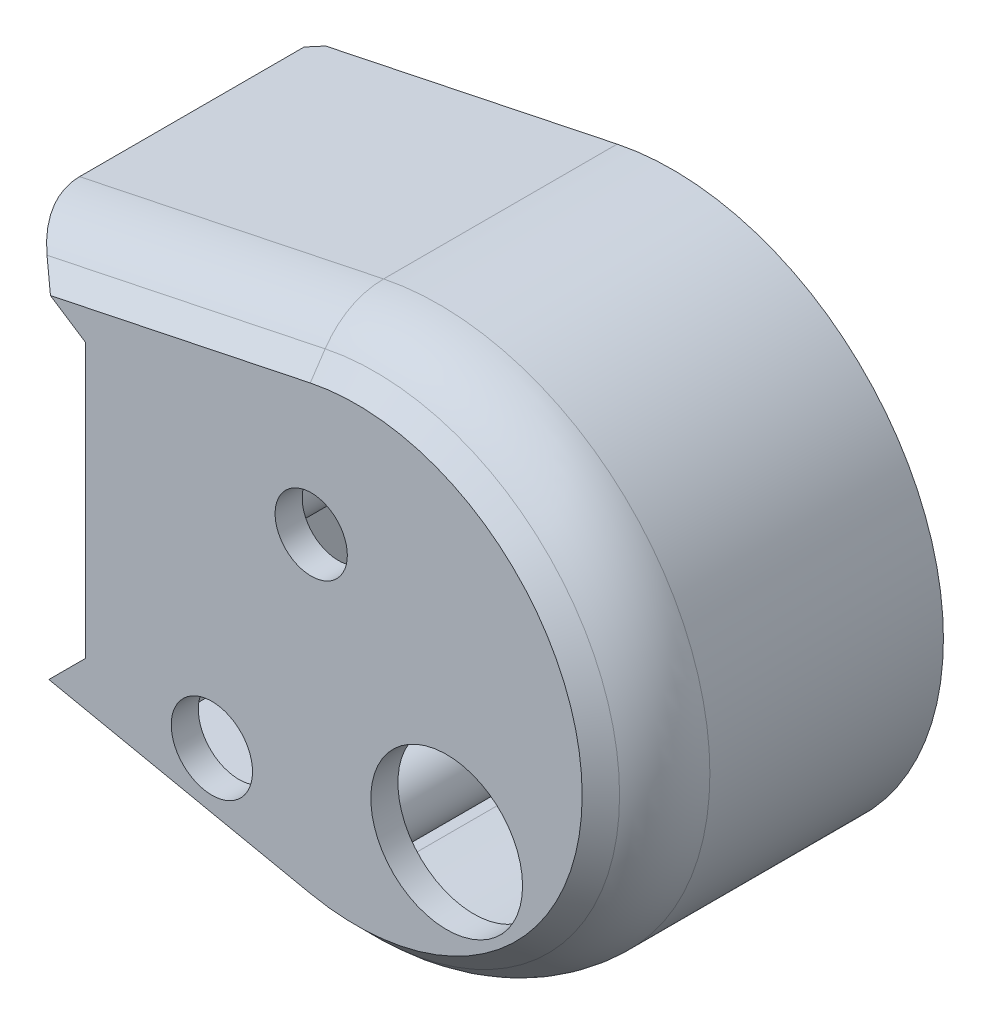
from build123d import *

# Parameters (mm, degrees)
CROQUIS13_R             = 4.5
CROQUIS13_R_2           = 8.4
CROQUIS13_R_3           = 4
SALIENTE_EXTRUIR5_DEPTH = 35
CORTAR_EXTRUIR7_DEPTH   = 32
CHAFL_N6_SIZE           = 5
CHAFL_N7_SIZE           = 2
CROQUIS15_R             = 4
CROQUIS15_R_2           = 1.25
SALIENTE_EXTRUIR9_DEPTH = 32
CHAFL_N8_SIZE           = 0.8
REDONDEO1_R             = 10
CHAFL_N9_SIZE           = 1


with BuildPart() as part:
    # Croquis13 → Saliente-Extruir5 (new body)
    with BuildSketch(Plane.XY):
        with BuildLine():
            Line((-6.126443354, 29.36778323), (-39.789261077, 22.345348329))
            Line((-39.789261077, 22.345348329), (-30, 15.935417314))
            Line((-30, 15.935417314), (-30, -14.387496114))
            Line((-30, -14.387496114), (-38.2739606, -22.661456714))
            Line((-38.2739606, -22.661456714), (-6.126443354, -29.36778323))
            ThreePointArc((-6.126443354, -29.36778323), (30, 0), (-6.126443354, 29.36778323))
        make_face()
        with Locations((-16, -16)):
            Circle(CROQUIS13_R, mode=Mode.SUBTRACT)
        with Locations((10, -12)):
            Circle(CROQUIS13_R_2, mode=Mode.SUBTRACT)
        with Locations((-5, 10)):
            Circle(CROQUIS13_R_3, mode=Mode.SUBTRACT)
    extrude(amount=-SALIENTE_EXTRUIR5_DEPTH)

    # Croquis14 → Cortar-Extruir7 (cut)
    with BuildSketch(Plane(origin=(0, 0, -35), x_dir=(-1, 0, 0), z_dir=(0, 0, -1))):
        with BuildLine():
            Line((27.5, -22.355204771), (5.615906408, -26.920467961))
            ThreePointArc((5.615906408, -26.920467961), (-27.5, 0), (5.615906408, 26.920467961))
            Line((5.615906408, 26.920467961), (27.5, 22.355204771))
            Line((27.5, 22.355204771), (27.5, -22.355204771))
        make_face()
    extrude(amount=-CORTAR_EXTRUIR7_DEPTH, mode=Mode.SUBTRACT)

    # Chaflán6
    chafl_n6_edges = [part.edges().sort_by_distance(p)[0] for p in [
        (-22.200201977, -26.014619972, 0),
        (-22.957852215, 25.856565779, 0),
        (30, 0, 0),
    ]]
    chamfer(chafl_n6_edges, length=CHAFL_N6_SIZE)

    # Chaflán7
    chafl_n7_edges = [part.edges().sort_by_distance(p)[0] for p in [
        (-16.557953204, 24.637836366, -3),
        (27.5, 0, -3),
        (-16.557953204, -24.637836366, -3),
    ]]
    chamfer(chafl_n7_edges, length=CHAFL_N7_SIZE)

    # Croquis15 → Saliente-Extruir9 (add)
    # profile 1 of 3: a face of its own
    with BuildSketch(Plane(origin=(0, 0, -3), x_dir=(-1, 0, 0), z_dir=(0, 0, -1))):
        with Locations(Location((22.5, 0, 0), (0, 0, 180))):
            Circle(CROQUIS15_R)
        with Locations(Location((22.5, 0, 0), (0, 0, 180))):
            Circle(CROQUIS15_R_2, mode=Mode.SUBTRACT)
    # profile 2 of 3: a face of its own
    with BuildSketch(Plane(origin=(0, 0, -3), x_dir=(-1, 0, 0), z_dir=(0, 0, -1))):
        with Locations(Location((6.952882373, -21.398771617, 0), (0, 0, 180))):
            Circle(CROQUIS15_R)
        with Locations(Location((6.952882373, -21.398771617, 0), (0, 0, 180))):
            Circle(CROQUIS15_R_2, mode=Mode.SUBTRACT)
    # profile 3 of 3: a face of its own
    with BuildSketch(Plane(origin=(0, 0, -3), x_dir=(-1, 0, 0), z_dir=(0, 0, -1))):
        with Locations(Location((-18.202882373, 13.225168177, 0), (0, 0, 180))):
            Circle(CROQUIS15_R)
        with Locations(Location((-18.202882373, 13.225168177, 0), (0, 0, 180))):
            Circle(CROQUIS15_R_2, mode=Mode.SUBTRACT)
    extrude(amount=SALIENTE_EXTRUIR9_DEPTH)

    # Chaflán8
    chafl_n8_edges = [part.edges().sort_by_distance(p)[0] for p in [
        (-23.75, 0, -35),
        (-8.202882373, -21.398771617, -35),
        (16.952882373, 13.225168177, -35),
    ]]
    chamfer(chafl_n8_edges, length=CHAFL_N8_SIZE)

    # Redondeo1
    redondeo1_edges = [part.edges().sort_by_distance(p)[0] for p in [
        (-22.957852215, 25.856565779, -5),
        (30, 0, -5),
        (-22.200201977, -26.014619972, -5),
    ]]
    fillet(redondeo1_edges, radius=REDONDEO1_R)

    # Chaflán9
    chafl_n9_edges = [part.edges().sort_by_distance(p)[0] for p in [
        (-34.894630538, 19.140382822, -35),
        (-30, 0.7739606, -35),
        (-34.1369803, -18.524476414, -35),
    ]]
    chamfer(chafl_n9_edges, length=CHAFL_N9_SIZE)


solid = part.part
